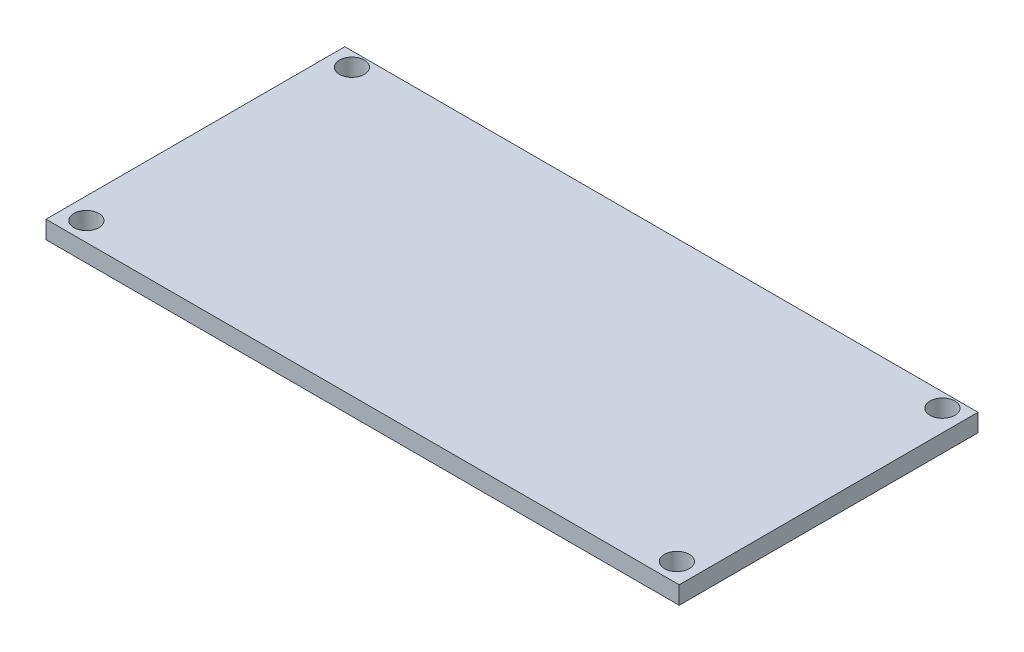
from build123d import *

# Parameters (mm, degrees)
SKETCH1_W           = 89
SKETCH1_H           = 42
BOSS_EXTRUDE1_DEPTH = 2.5
SKETCH3_R           = 1.75
CUT_EXTRUDE1_DEPTH  = 99.444146601


with BuildPart() as part:
    # Sketch1 → Boss-Extrude1 (new body)
    with BuildSketch(Plane(origin=(0, 0, 0), x_dir=(1, 0, 0), z_dir=(0, 1, 0))):
        with Locations((44.5, 21)):
            Rectangle(SKETCH1_W, SKETCH1_H)
    extrude(amount=BOSS_EXTRUDE1_DEPTH)

    # Sketch3 → Cut-Extrude1 (cut, through all)
    with BuildSketch(Plane(origin=(0, 2.5, 0), x_dir=(1, 0, 0), z_dir=(0, 1, 0))):
        with Locations(Location((3, 40, 0), (0, 0, 270))):
            Circle(SKETCH3_R)
        with Locations(Location((86, 40, 0), (0, 0, 90))):
            Circle(SKETCH3_R)
        with Locations(Location((86, 2.67459782, 0), (0, 0, 270))):
            Circle(SKETCH3_R)
        with Locations(Location((3, 2.67459782, 0), (0, 0, 90))):
            Circle(SKETCH3_R)
    extrude(amount=-CUT_EXTRUDE1_DEPTH, mode=Mode.SUBTRACT)


solid = part.part
